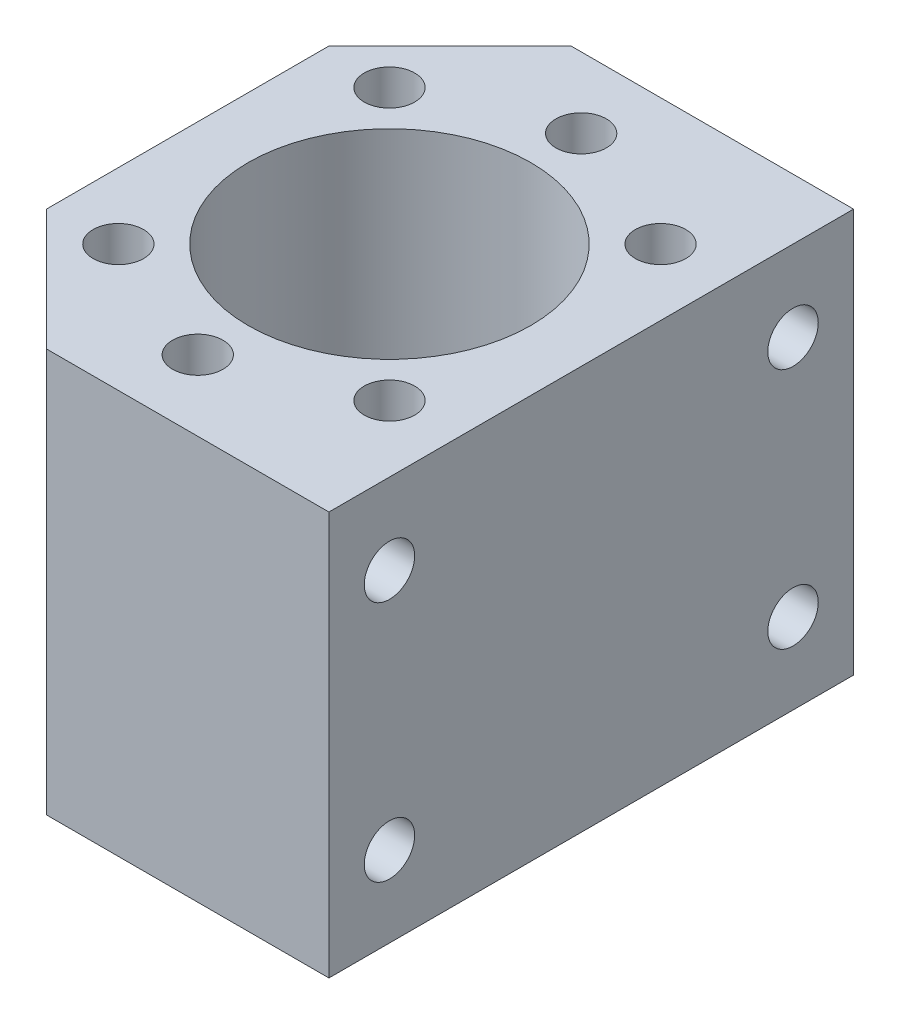
from build123d import *

# Parameters (mm, degrees)
SKETCH2_W           = 40
SKETCH2_H           = 52
BOSS_EXTRUDE1_DEPTH = 40
SKETCH3_R           = 14
CUT_EXTRUDE1_DEPTH  = 40
CUT_EXTRUDE2_DEPTH  = 40
SKETCH5_R           = 2.5
CUT_EXTRUDE3_DEPTH  = 20
SKETCH6_R           = 2.5
CUT_EXTRUDE4_DEPTH  = 15


with BuildPart() as part:
    # Sketch2 → Boss-Extrude1 (new body)
    with BuildSketch(Plane(origin=(0, 0, 0), x_dir=(1, 0, 0), z_dir=(0, 1, 0))):
        with Locations((20, -26)):
            Rectangle(SKETCH2_W, SKETCH2_H)
    extrude(amount=BOSS_EXTRUDE1_DEPTH)

    # Sketch3 → Cut-Extrude1 (cut)
    with BuildSketch(Plane(origin=(0, 40, 0), x_dir=(1, 0, 0), z_dir=(0, 1, 0))):
        with Locations(Location((20, -26, 0), (0, 0, 270))):
            Circle(SKETCH3_R)
    extrude(amount=-CUT_EXTRUDE1_DEPTH, mode=Mode.SUBTRACT)

    # Sketch4 → Cut-Extrude2 (cut)
    with BuildSketch(Plane(origin=(0, 40, 0), x_dir=(1, 0, 0), z_dir=(0, 1, 0))):
        Polygon((0, -52), (12, -52), (0, -40), align=None)
        Polygon((0, 0), (12, 0), (0, -12), align=None)
    extrude(amount=-CUT_EXTRUDE2_DEPTH, mode=Mode.SUBTRACT)

    # Sketch5 → Cut-Extrude3 (cut)
    with BuildSketch(Plane(origin=(0, 40, 0), x_dir=(1, 0, 0), z_dir=(0, 1, 0))):
        with Locations(Location((20, -7, 0), (0, 0, 270))):
            Circle(SKETCH5_R)
        with Locations(Location((20, -45, 0), (0, 0, 270))):
            Circle(SKETCH5_R)
        with Locations(Location((33.435028843, -39.435028843, 0), (0, 0, 270))):
            Circle(SKETCH5_R)
        with Locations(Location((33.435028843, -12.564971157, 0), (0, 0, 270))):
            Circle(SKETCH5_R)
        with Locations(Location((6.564971157, -12.564971157, 0), (0, 0, 270))):
            Circle(SKETCH5_R)
        with Locations(Location((6.564971157, -39.435028843, 0), (0, 0, 270))):
            Circle(SKETCH5_R)
    extrude(amount=-CUT_EXTRUDE3_DEPTH, mode=Mode.SUBTRACT)

    # Sketch6 → Cut-Extrude4 (cut)
    with BuildSketch(Plane(origin=(40, 0, 0), x_dir=(0, 0, -1), z_dir=(1, 0, 0))):
        with Locations((-46, 32)):
            Circle(SKETCH6_R)
        with Locations((-46, 8)):
            Circle(SKETCH6_R)
        with Locations((-6, 8)):
            Circle(SKETCH6_R)
        with Locations((-6, 32)):
            Circle(SKETCH6_R)
    extrude(amount=-CUT_EXTRUDE4_DEPTH, mode=Mode.SUBTRACT)


solid = part.part
